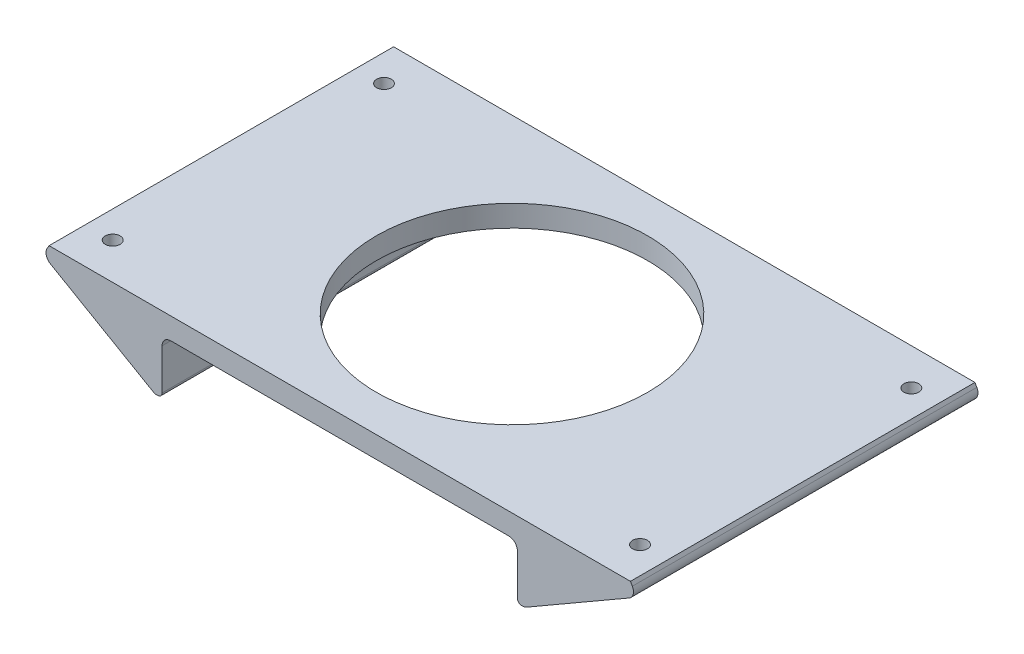
from build123d import *

# Parameters (mm, degrees)
BOSS_EXTRUDE1_DEPTH = 101.6
SKETCH2_R           = 2.1844
SKETCH2_R_2         = 40.005
CUT_EXTRUDE1_DEPTH  = 136.951937251
FILLET1_R           = 2.54
FILLET2_R           = 1.27


with BuildPart() as part:
    # Sketch1 → Boss-Extrude1 (new body)
    with BuildSketch(Plane.XY):
        Polygon((85.725, 0), (-85.725, 0), (-87.558087105, -3.175), (-54.56251922, -22.225), (-52.3875, -22.225), (-52.3875, -6.35), (52.3875, -6.35), (52.3875, -22.225), (54.56251922, -22.225), (87.558087105, -3.175), align=None)
    extrude(amount=BOSS_EXTRUDE1_DEPTH)

    # Sketch2 → Cut-Extrude1 (cut, through all)
    with BuildSketch(Plane(origin=(0, 0, 0), x_dir=(1, 0, 0), z_dir=(0, 1, 0))):
        with Locations(Location((77.75575, -90.805, 0), (0, 0, 180))):
            Circle(SKETCH2_R)
        with Locations(Location((-77.75575, -90.805, 0), (0, 0, 180))):
            Circle(SKETCH2_R)
        with Locations(Location((-77.75575, -10.795, 0), (0, 0, 180))):
            Circle(SKETCH2_R)
        with Locations((77.75575, -10.795)):
            Circle(SKETCH2_R)
        with Locations(Location((0, -50.8, 0), (0, 0, 180))):
            Circle(SKETCH2_R_2)
    extrude(amount=-CUT_EXTRUDE1_DEPTH, mode=Mode.SUBTRACT)

    # Fillet1
    fillet1_edges = [part.edges().sort_by_distance(p)[0] for p in [
        (87.558087105, -3.175, 50.8),
        (52.3875, -6.35, 50.8),
        (-52.3875, -6.35, 50.8),
        (-87.558087105, -3.175, 50.8),
    ]]
    fillet(fillet1_edges, radius=FILLET1_R)

    # Fillet2
    fillet2_edges = [part.edges().sort_by_distance(p)[0] for p in [
        (54.56251922, -22.225, 50.8),
        (52.3875, -22.225, 50.8),
        (-52.3875, -22.225, 50.8),
        (-54.56251922, -22.225, 50.8),
    ]]
    fillet(fillet2_edges, radius=FILLET2_R)


solid = part.part
